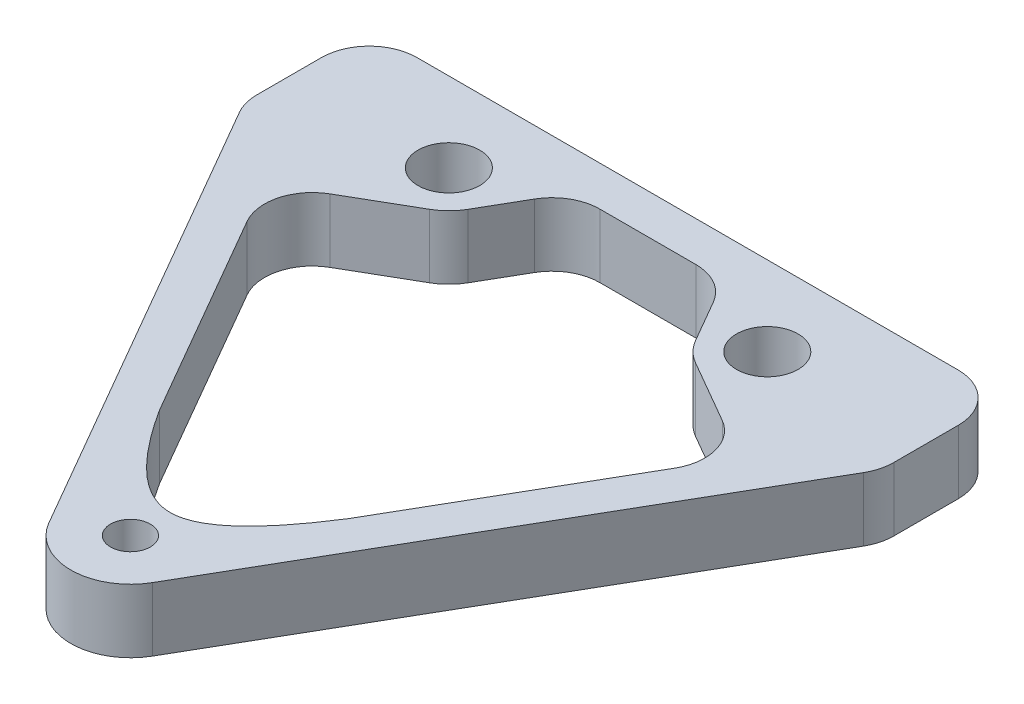
from build123d import *

# Parameters (mm, degrees)
SKETCH1_W                    = 50.8
SKETCH1_H                    = 6.35
BOSS_EXTRUDE1_DEPTH          = 5.08
F_10_0_1935_DIAMETER_HOLE1_D = 4.9149
F_1_8_0_1250_DOWEL_HOLE1_D   = 3.175
CUT_EXTRUDE1_DEPTH           = 56.613276798
FILLET1_R                    = 3.81


with BuildPart() as part:
    # Sketch1 → Boss-Extrude1 (new body)
    with BuildSketch(Plane(origin=(0, 0, 0), x_dir=(1, 0, 0), z_dir=(0, 1, 0))):
        with BuildLine():
            Line((25.4, -6.35), (-25.4, -6.35))
            Line((-25.4, -6.35), (-25.4, -9.980909488))
            Line((-25.4, -9.980909488), (-4.124445986, -46.83125))
            ThreePointArc((-4.124445986, -46.83125), (0, -49.2125), (4.124445986, -46.83125))
            Line((4.124445986, -46.83125), (25.4, -9.980909488))
            Line((25.4, -9.980909488), (25.4, -6.35))
        make_face()
        with Locations((0, -3.175)):
            Rectangle(SKETCH1_W, SKETCH1_H)
    extrude(amount=BOSS_EXTRUDE1_DEPTH)

    # #10 (0.1935) Diameter Hole1 (through all)
    with Locations(Plane(origin=(0, 5.08, 0), x_dir=(1, 0, 0), z_dir=(0, 1, 0))):
        with Locations((-12.7, -6.35), (12.7, -6.35)):
            Hole(F_10_0_1935_DIAMETER_HOLE1_D / 2)

    # 1/8 (0.1250) Dowel Hole1 (through all)
    with Locations(Plane(origin=(0, 5.08, 0), x_dir=(1, 0, 0), z_dir=(0, 1, 0))):
        with Locations((0, -44.45)):
            Hole(F_1_8_0_1250_DOWEL_HOLE1_D / 2)

    # Sketch4 → Cut-Extrude1 (cut, through all)
    with BuildSketch(Plane(origin=(0, 5.08, 0), x_dir=(1, 0, 0), z_dir=(0, 1, 0))):
        with BuildLine():
            Line((-6.027562939, -3.175), (-9.070487533, -8.4455))
            ThreePointArc((-9.070487533, -8.4455), (-9.73651548, -9.31348452), (-10.6045, -9.979512467))
            Line((-10.6045, -9.979512467), (-18.952099271, -14.799001153))
            Line((-18.952099271, -14.799001153), (-11.799907664, -27.186960401))
            Line((-11.799907664, -27.186960401), (-7.506626388, -34.623141702))
            add(Edge.make_bspline(
                [(7.506626388, -34.623141702), (5.246523419, -38.15236124), (0, -44.39763876), (-5.246523419, -38.15236124), (-7.506626388, -34.623141702)],
                knots=[0.213351666, 0.213351666, 0.213351666, 0.213351666, 0.5, 0.786648334, 0.786648334, 0.786648334, 0.786648334], degree=3))
            Line((7.506626388, -34.623141702), (11.799907664, -27.186960401))
            Line((11.799907664, -27.186960401), (18.952099271, -14.799001153))
            Line((18.952099271, -14.799001153), (10.6045, -9.979512467))
            ThreePointArc((10.6045, -9.979512467), (9.73651548, -9.31348452), (9.070487533, -8.4455))
            Line((9.070487533, -8.4455), (6.027562939, -3.175))
            Line((6.027562939, -3.175), (-6.027562939, -3.175))
        make_face()
    extrude(amount=-CUT_EXTRUDE1_DEPTH, mode=Mode.SUBTRACT)

    # Fillet1
    fillet1_edges = [part.edges().sort_by_distance(p)[0] for p in [
        (-25.4, 2.54, 9.980909488),
        (-25.4, 2.54, 0),
        (25.4, 2.54, 0),
        (25.4, 2.54, 9.980909488),
        (-18.952099271, 2.54, 14.799001153),
        (-6.027562939, 2.54, 3.175),
        (6.027562939, 2.54, 3.175),
        (18.952099271, 2.54, 14.799001153),
    ]]
    fillet(fillet1_edges, radius=FILLET1_R)


solid = part.part
